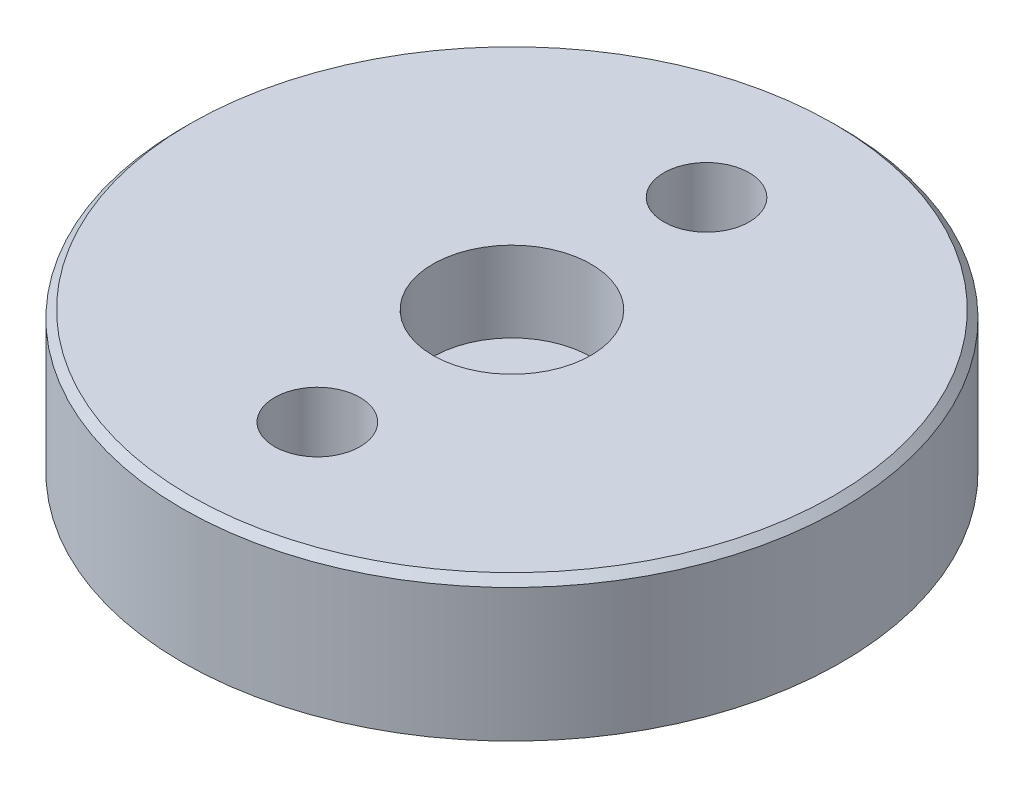
from build123d import *

# Parameters (mm, degrees)
SKETCH8_R           = 13.125
BOSS_EXTRUDE2_DEPTH = 5.6
SKETCH9_R           = 11.125
CUT_EXTRUDE4_DEPTH  = 1
SKETCH10_R          = 3.15
CUT_EXTRUDE5_DEPTH  = 3.2
CHAMFER2_SIZE       = 0.3
SKETCH11_R          = 1.7
CUT_EXTRUDE6_DEPTH  = 20.38791505


with BuildPart() as part:
    # Sketch8 → Boss-Extrude2 (new body)
    with BuildSketch(Plane(origin=(0, -463.275483874, 0), x_dir=(0.32790942623068436, 0, 0.9447091659283631), z_dir=(0, 1, 0))):
        with Locations(Location((0, 0, 0), (0, 0, 340.858064804))):
            Circle(SKETCH8_R)
    extrude(amount=-BOSS_EXTRUDE2_DEPTH)

    # Sketch9 → Cut-Extrude4 (cut)
    with BuildSketch(Plane(origin=(0, -468.875483874, 0), x_dir=(-1, 0, 0), z_dir=(0, -1, 0))):
        with Locations(Location((0, 0, 0), (0, 0, 90))):
            Circle(SKETCH9_R)
    extrude(amount=-CUT_EXTRUDE4_DEPTH, mode=Mode.SUBTRACT)

    # Sketch10 → Cut-Extrude5 (cut)
    with BuildSketch(Plane(origin=(0, -463.275483874, 0), x_dir=(1, 0, 0), z_dir=(0, 1, 0))):
        with Locations(Location((0, 0, 0), (0, 0, 270))):
            Circle(SKETCH10_R)
    extrude(amount=-CUT_EXTRUDE5_DEPTH, mode=Mode.SUBTRACT)

    # Chamfer2
    chamfer2_edges = [part.edges().sort_by_distance(p)[0] for p in [
        (0, -463.275483874, -13.125),
    ]]
    chamfer(chamfer2_edges, length=CHAMFER2_SIZE)

    # Sketch11 → Cut-Extrude6 (cut, through all)
    with BuildSketch(Plane(origin=(0, -463.275483874, 0), x_dir=(1, 0, 0), z_dir=(0, 1, 0))):
        with Locations(Location((0, -7.75, 0), (0, 0, 270))):
            Circle(SKETCH11_R)
        with Locations(Location((0, 7.75, 0), (0, 0, 270))):
            Circle(SKETCH11_R)
    extrude(amount=-CUT_EXTRUDE6_DEPTH, mode=Mode.SUBTRACT)


solid = part.part
